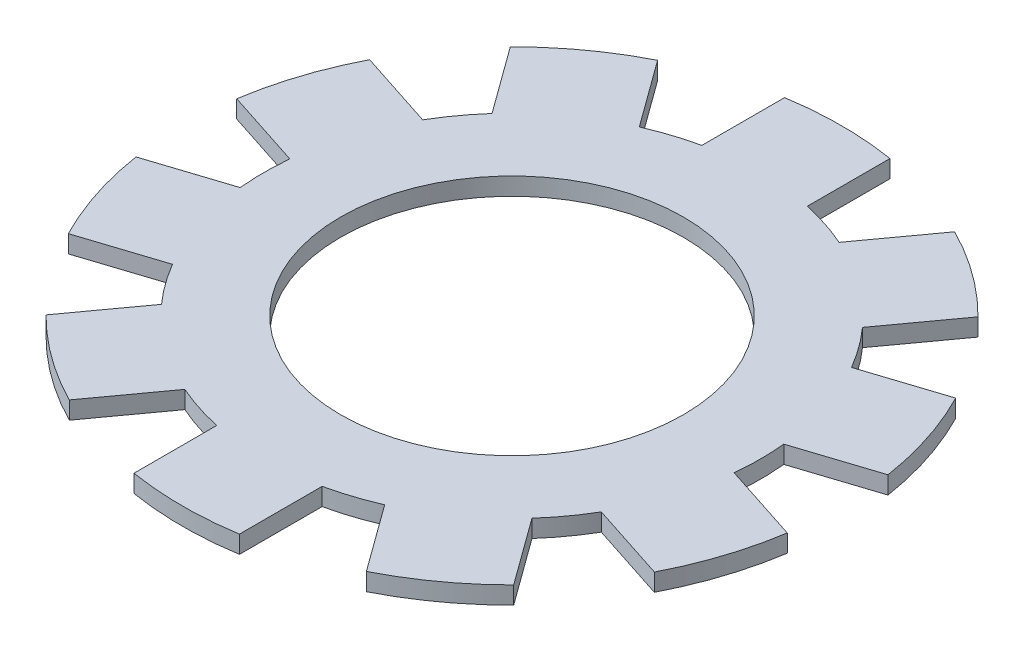
from build123d import *

# Parameters (mm, degrees)
SKETCH1_R           = 3.9
BOSS_EXTRUDE1_DEPTH = 0.4


with BuildPart() as part:
    # Sketch1 → Boss-Extrude1 (new body)
    with BuildSketch(Plane(origin=(0, 0, 0), x_dir=(1, 0, 0), z_dir=(0, 1, 0))):
        with BuildLine():
            Line((-1.2, 5.521095906), (-1.2, 7.403377608))
            ThreePointArc((-1.2, 7.403377608), (-0.601941834, 7.475805377), (0, 7.5))
            ThreePointArc((0, 7.5), (0.601941834, 7.475805377), (1.2, 7.403377608))
            Line((1.2, 7.403377608), (1.2, 5.521095906))
            ThreePointArc((1.2, 5.521095906), (1.745946018, 5.373469317), (2.274398357, 5.172002718))
            Line((2.274398357, 5.172002718), (3.380775782, 6.694800603))
            ThreePointArc((3.380775782, 6.694800603), (3.907186976, 6.401866129), (4.408389392, 6.067627458))
            ThreePointArc((4.408389392, 6.067627458), (4.881149323, 5.694241063), (5.322416568, 5.284115998))
            Line((5.322416568, 5.284115998), (4.216039143, 3.761318113))
            ThreePointArc((4.216039143, 3.761318113), (4.570946018, 3.320986675), (4.880053845, 2.847380282))
            Line((4.880053845, 2.847380282), (6.670210123, 3.429037316))
            ThreePointArc((6.670210123, 3.429037316), (6.923903162, 2.882631612), (7.132923872, 2.317627458))
            ThreePointArc((7.132923872, 2.317627458), (7.295923674, 1.737670204), (7.41185091, 1.146501677))
            Line((7.41185091, 1.146501677), (5.621694631, 0.564844643))
            ThreePointArc((5.621694631, 0.564844643), (5.65, 0), (5.621694631, -0.564844643))
            Line((5.621694631, -0.564844643), (7.41185091, -1.146501677))
            ThreePointArc((7.41185091, -1.146501677), (7.295923674, -1.737670204), (7.132923872, -2.317627458))
            ThreePointArc((7.132923872, -2.317627458), (6.923903162, -2.882631612), (6.670210123, -3.429037316))
            Line((6.670210123, -3.429037316), (4.880053845, -2.847380282))
            ThreePointArc((4.880053845, -2.847380282), (4.570946018, -3.320986675), (4.216039143, -3.761318113))
            Line((4.216039143, -3.761318113), (5.322416568, -5.284115998))
            ThreePointArc((5.322416568, -5.284115998), (4.881149323, -5.694241063), (4.408389392, -6.067627458))
            ThreePointArc((4.408389392, -6.067627458), (3.907186976, -6.401866129), (3.380775782, -6.694800603))
            Line((3.380775782, -6.694800603), (2.274398357, -5.172002718))
            ThreePointArc((2.274398357, -5.172002718), (1.745946018, -5.373469317), (1.2, -5.521095906))
            Line((1.2, -5.521095906), (1.2, -7.403377608))
            ThreePointArc((1.2, -7.403377608), (0.601941834, -7.475805377), (0, -7.5))
            ThreePointArc((0, -7.5), (-0.601941834, -7.475805377), (-1.2, -7.403377608))
            Line((-1.2, -7.403377608), (-1.2, -5.521095906))
            ThreePointArc((-1.2, -5.521095906), (-1.745946018, -5.373469317), (-2.274398357, -5.172002718))
            Line((-2.274398357, -5.172002718), (-3.380775782, -6.694800603))
            ThreePointArc((-3.380775782, -6.694800603), (-3.907186976, -6.401866129), (-4.408389392, -6.067627458))
            ThreePointArc((-4.408389392, -6.067627458), (-4.881149323, -5.694241063), (-5.322416568, -5.284115998))
            Line((-5.322416568, -5.284115998), (-4.216039143, -3.761318113))
            ThreePointArc((-4.216039143, -3.761318113), (-4.570946018, -3.320986675), (-4.880053845, -2.847380282))
            Line((-4.880053845, -2.847380282), (-6.670210123, -3.429037316))
            ThreePointArc((-6.670210123, -3.429037316), (-6.923903162, -2.882631612), (-7.132923872, -2.317627458))
            ThreePointArc((-7.132923872, -2.317627458), (-7.295923674, -1.737670204), (-7.41185091, -1.146501677))
            Line((-7.41185091, -1.146501677), (-5.621694631, -0.564844643))
            ThreePointArc((-5.621694631, -0.564844643), (-5.65, 0), (-5.621694631, 0.564844643))
            Line((-5.621694631, 0.564844643), (-7.41185091, 1.146501677))
            ThreePointArc((-7.41185091, 1.146501677), (-7.295923674, 1.737670204), (-7.132923872, 2.317627458))
            ThreePointArc((-7.132923872, 2.317627458), (-6.923903162, 2.882631612), (-6.670210123, 3.429037316))
            Line((-6.670210123, 3.429037316), (-4.880053845, 2.847380282))
            ThreePointArc((-4.880053845, 2.847380282), (-4.570946018, 3.320986675), (-4.216039143, 3.761318113))
            Line((-4.216039143, 3.761318113), (-5.322416568, 5.284115998))
            ThreePointArc((-5.322416568, 5.284115998), (-4.881149323, 5.694241063), (-4.408389392, 6.067627458))
            ThreePointArc((-4.408389392, 6.067627458), (-3.907186976, 6.401866129), (-3.380775782, 6.694800603))
            Line((-3.380775782, 6.694800603), (-2.274398357, 5.172002718))
            ThreePointArc((-2.274398357, 5.172002718), (-1.745946018, 5.373469317), (-1.2, 5.521095906))
        make_face()
        with Locations(Location((0, 0, 0), (0, 0, 270))):
            Circle(SKETCH1_R, mode=Mode.SUBTRACT)
    extrude(amount=BOSS_EXTRUDE1_DEPTH)


solid = part.part
